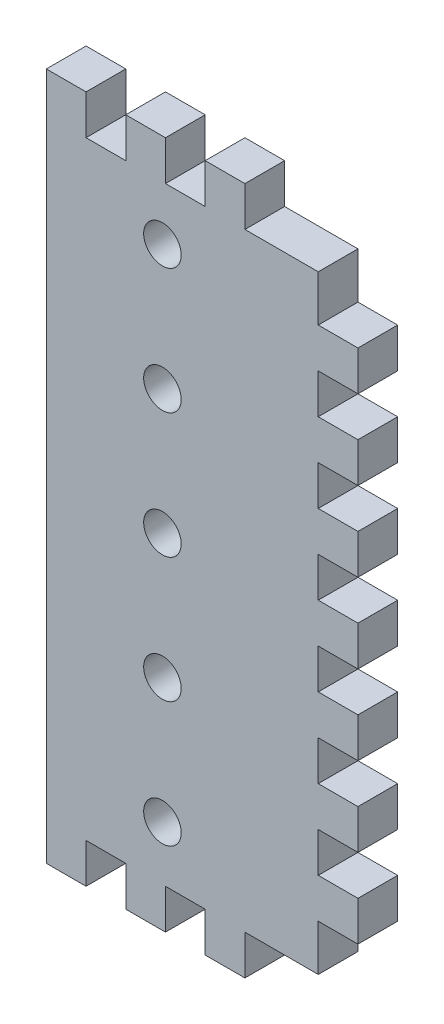
from build123d import *

# Parameters (mm, degrees)
SKETCH1_W               = 31.2625
SKETCH1_H               = 55
BOSS_EXTRUDE1_DEPTH     = 3.175
SKETCH2_R               = 1.5
CUT_EXTRUDE1_DEPTH      = 10
LPATTERN1_COUNT         = 3
LPATTERN1_PITCH         = 10
LPATTERN1_COL_COUNT     = 3
LPATTERN1_COL_PITCH     = 10
SKETCH3_W               = 6.35
SKETCH3_H               = 3.175
CUT_EXTRUDE2_DEPTH      = 10
LPATTERN2_COUNT         = 5
LPATTERN2_PITCH         = 6.35
LPATTERN2_COL_COUNT     = 5
LPATTERN2_COL_PITCH     = 6.35
SKETCH4_W               = 3.175
SKETCH4_H               = 3.6875
SKETCH4_H_2             = 3.175
CUT_EXTRUDE3_DEPTH      = 10
SKETCH5_W               = 6.35
SKETCH5_H               = 55
CUT_EXTRUDE4_DEPTH      = 10
SKETCH6_W               = 3.175
SKETCH6_H               = 3.175
CUT_EXTRUDE5_DEPTH      = 10
LPATTERN3_COUNT         = 2
LPATTERN3_PITCH         = 6.35
LPATTERN3_COUNT_DIR2    = 2
LPATTERN3_PITCH_DIR2    = 6.35
SKETCH7_W               = 5.8625
SKETCH7_H               = 3.175
CUT_EXTRUDE6_DEPTH      = 10
MIRROR1_COPY_1_SKETCH_W = 3.175
MIRROR1_COPY_1_SKETCH_H = 3.175
MIRROR1_COPY_1_DEPTH    = 10
MIRROR1_COPY_2_SKETCH_W = 3.175
MIRROR1_COPY_2_SKETCH_H = 3.175
MIRROR1_COPY_2_DEPTH    = 10
MIRROR1_COPY_3_SKETCH_W = 3.175
MIRROR1_COPY_3_SKETCH_H = 3.175
MIRROR1_COPY_3_DEPTH    = 10


with BuildPart() as part:
    # Sketch1 → Boss-Extrude1 (new body)
    with BuildSketch(Plane.XY):
        Rectangle(SKETCH1_W, SKETCH1_H)
    extrude(amount=BOSS_EXTRUDE1_DEPTH)

    # Sketch2 → Cut-Extrude1 (cut)
    with BuildSketch(Plane.XY.offset(3.175)):
        Circle(SKETCH2_R)
    cut_extrude1 = extrude(amount=-CUT_EXTRUDE1_DEPTH, mode=Mode.SUBTRACT)

    # LPattern1: Cut-Extrude1 ×3
    with Locations(*[(0, i * LPATTERN1_PITCH, 0) for i in range(1, LPATTERN1_COUNT)]):
        add(cut_extrude1, mode=Mode.SUBTRACT)

    # LPattern1 col: Cut-Extrude1 ×3
    with Locations(*[(0, -i * LPATTERN1_COL_PITCH, 0) for i in range(1, LPATTERN1_COL_COUNT)]):
        add(cut_extrude1, mode=Mode.SUBTRACT)

    # Sketch3 → Cut-Extrude2 (cut)
    with BuildSketch(Plane.XY.offset(3.175)):
        with Locations((15.63125, -3.175)):
            Rectangle(SKETCH3_W, SKETCH3_H)
    cut_extrude2 = extrude(amount=-CUT_EXTRUDE2_DEPTH, mode=Mode.SUBTRACT)

    # LPattern2: Cut-Extrude2 ×5
    with Locations(*[(0, i * LPATTERN2_PITCH, 0) for i in range(1, LPATTERN2_COUNT)]):
        add(cut_extrude2, mode=Mode.SUBTRACT)

    # LPattern2 col: Cut-Extrude2 ×5
    with Locations(*[(0, -i * LPATTERN2_COL_PITCH, 0) for i in range(1, LPATTERN2_COL_COUNT)]):
        add(cut_extrude2, mode=Mode.SUBTRACT)

    # Sketch4 → Cut-Extrude3 (cut)
    with BuildSketch(Plane.XY.offset(3.175)):
        with Locations((14.04375, 25.65625)):
            Rectangle(SKETCH4_W, SKETCH4_H)
        with Locations((14.04375, -25.4)):
            Rectangle(SKETCH4_W, SKETCH4_H_2)
    extrude(amount=-CUT_EXTRUDE3_DEPTH, mode=Mode.SUBTRACT)

    # Sketch5 → Cut-Extrude4 (cut)
    with BuildSketch(Plane.XY.offset(3.175)):
        with Locations((-12.45625, 0)):
            Rectangle(SKETCH5_W, SKETCH5_H)
    extrude(amount=-CUT_EXTRUDE4_DEPTH, mode=Mode.SUBTRACT)

    # Sketch6 → Cut-Extrude5 (cut)
    with BuildSketch(Plane.XY.offset(3.175)):
        with Locations((-4.51875, 25.9125)):
            Rectangle(SKETCH6_W, SKETCH6_H)
    cut_extrude5 = extrude(amount=-CUT_EXTRUDE5_DEPTH, mode=Mode.SUBTRACT)

    # LPattern3: Cut-Extrude5 2 × 2
    with Locations(*[(i * LPATTERN3_PITCH, j * LPATTERN3_PITCH_DIR2, 0) for i in range(LPATTERN3_COUNT) for j in range(LPATTERN3_COUNT_DIR2) if (i, j) != (0, 0)]):
        add(cut_extrude5, mode=Mode.SUBTRACT)

    # Sketch7 → Cut-Extrude6 (cut)
    with BuildSketch(Plane.XY.offset(3.175)):
        with Locations((9.525, 25.9125)):
            Rectangle(SKETCH7_W, SKETCH7_H)
    cut_extrude6 = extrude(amount=-CUT_EXTRUDE6_DEPTH, mode=Mode.SUBTRACT)

    # Mirror1: Cut-Extrude5, Cut-Extrude6 across plane
    add(cut_extrude5.mirror(Plane.ZX), mode=Mode.SUBTRACT)
    add(cut_extrude6.mirror(Plane.ZX), mode=Mode.SUBTRACT)

    # Mirror1 copy 1 sketch → Mirror1 copy 1 (cut)
    with BuildSketch(Plane(origin=(0, -6.35, 3.175), x_dir=(1, 0, 0), z_dir=(0, 0, 1))):
        with Locations((-4.51875, -25.9125)):
            Rectangle(MIRROR1_COPY_1_SKETCH_W, MIRROR1_COPY_1_SKETCH_H)
    extrude(amount=-MIRROR1_COPY_1_DEPTH, mode=Mode.SUBTRACT)

    # Mirror1 copy 2 sketch → Mirror1 copy 2 (cut)
    with BuildSketch(Plane(origin=(6.35, 0, 3.175), x_dir=(1, 0, 0), z_dir=(0, 0, 1))):
        with Locations((-4.51875, -25.9125)):
            Rectangle(MIRROR1_COPY_2_SKETCH_W, MIRROR1_COPY_2_SKETCH_H)
    extrude(amount=-MIRROR1_COPY_2_DEPTH, mode=Mode.SUBTRACT)

    # Mirror1 copy 3 sketch → Mirror1 copy 3 (cut)
    with BuildSketch(Plane(origin=(6.35, -6.35, 3.175), x_dir=(1, 0, 0), z_dir=(0, 0, 1))):
        with Locations((-4.51875, -25.9125)):
            Rectangle(MIRROR1_COPY_3_SKETCH_W, MIRROR1_COPY_3_SKETCH_H)
    extrude(amount=-MIRROR1_COPY_3_DEPTH, mode=Mode.SUBTRACT)


solid = part.part
